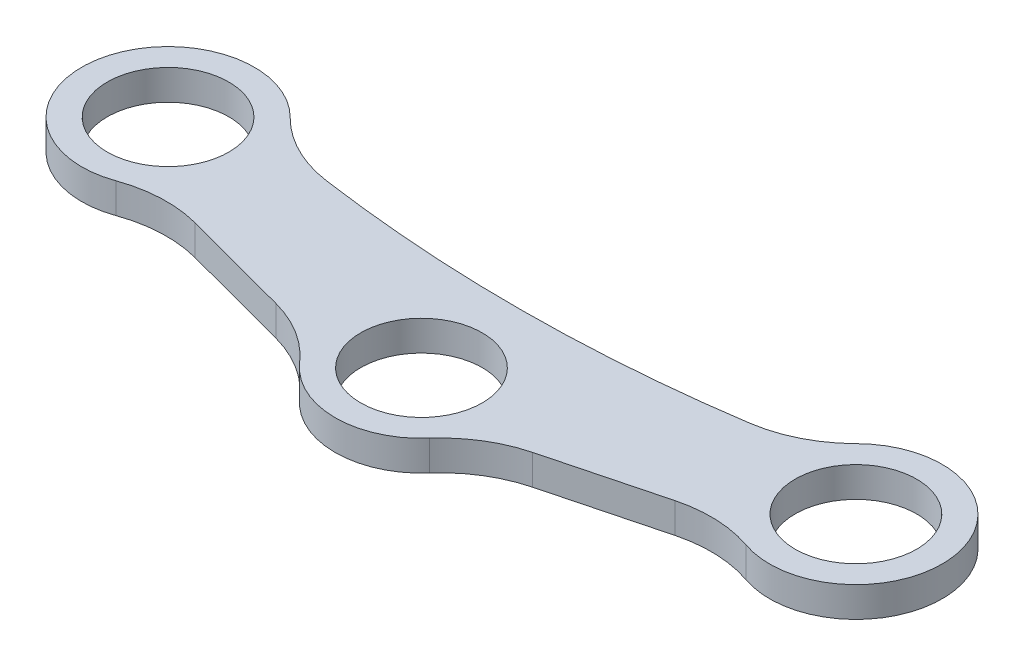
from build123d import *

# Parameters (mm, degrees)
SKETCH1_R           = 4.05
BOSS_EXTRUDE1_DEPTH = 5
SCALE1_SCALE        = 0.471698113
SKETCH2_R           = 1.910377358
BOSS_EXTRUDE2_DEPTH = 4.716981
SKETCH3_R           = 9.5
CUT_EXTRUDE1_DEPTH  = 78.491048109
FILLET1_R           = 20


with BuildPart() as part:
    # Sketch1 → Boss-Extrude1 (new, symmetric)
    with BuildSketch(Plane(origin=(0, 0, 0), x_dir=(1, 0, 0), z_dir=(0, 1, 0))):
        with BuildLine():
            Line((-115.945353012, 22.704926206), (-2.044938074, -7.668517777))
            ThreePointArc((-2.044938074, -7.668517777), (-0.023122965, -7.936460291), (2.000219114, -7.680303388))
            Line((2.000219114, -7.680303388), (116.075928336, 22.028993564))
            ThreePointArc((116.075928336, 22.028993564), (121.992194313, 31.992800071), (112.09054435, 38.012515284))
            ThreePointArc((112.09054435, 38.012515284), (-0.062996347, 24.666684437), (-112.292885137, 37.35447203))
            ThreePointArc((-112.292885137, 37.35447203), (-121.325741435, 31.826475412), (-115.945353012, 22.704926206))
        make_face()
        with Locations(Location((0, 0, 0), (0, 0, 270))):
            Circle(SKETCH1_R, mode=Mode.SUBTRACT)
        with Locations(Location((114, 30, 0), (0, 0, 270))):
            Circle(SKETCH1_R, mode=Mode.SUBTRACT)
        with Locations(Location((-114, 30, 0), (0, 0, 270))):
            Circle(SKETCH1_R, mode=Mode.SUBTRACT)
    extrude(amount=BOSS_EXTRUDE1_DEPTH, both=True)


with BuildPart() as part_1:
    # Scale1: scaled about (1.578802129, 0, -17.052920202)
    add(part.part.scale(SCALE1_SCALE).moved(Location((0.834084144, 0, -9.009089918))))

    # Sketch2 → Boss-Extrude2 (add, through all)
    with BuildSketch(Plane(origin=(0, 2.358490566, 0), x_dir=(1, 0, 0), z_dir=(0, 1, 0))):
        with BuildLine():
            Line((13.487042299, 4.302429752), (45.990989369, 12.76759225))
            ThreePointArc((45.990989369, 12.76759225), (67.744107555, 26.27194324), (42.244562907, 28.582542559))
            ThreePointArc((42.244562907, 28.582542559), (0.907570824, 24.644667364), (-40.455525682, 28.298161983))
            ThreePointArc((-40.455525682, 28.298161983), (-66.076792027, 26.268341249), (-44.081633602, 12.97238445))
            Line((-44.081633602, 12.97238445), (-11.846084783, 4.376238098))
            ThreePointArc((-11.846084783, 4.376238098), (0.794751912, -4.490852784), (13.487042299, 4.302429752))
        make_face()
        with Locations(Location((54.607669049, 23.160033314, 0), (0, 0, 270))):
            Circle(SKETCH2_R, mode=Mode.SUBTRACT)
        with Locations(Location((0.834084144, 9.009089918, 0), (0, 0, 270))):
            Circle(SKETCH2_R, mode=Mode.SUBTRACT)
        with Locations(Location((-52.939500762, 23.160033314, 0), (0, 0, 270))):
            Circle(SKETCH2_R, mode=Mode.SUBTRACT)
    extrude(amount=-BOSS_EXTRUDE2_DEPTH)

    # Sketch3 → Cut-Extrude1 (cut, through all)
    with BuildSketch(Plane(origin=(0, 2.358490566, 0), x_dir=(1, 0, 0), z_dir=(0, 1, 0))):
        with Locations(Location((-52.939500762, 23.160033314, 0), (0, 0, 270))):
            Circle(SKETCH3_R)
        with Locations(Location((0.834084144, 9.009089918, 0), (0, 0, 270))):
            Circle(SKETCH3_R)
        with Locations(Location((54.607669049, 23.160033314, 0), (0, 0, 270))):
            Circle(SKETCH3_R)
    extrude(amount=-CUT_EXTRUDE1_DEPTH, mode=Mode.SUBTRACT)

    # Fillet1
    fillet1_edges = [part_1.edges().sort_by_distance(p)[0] for p in [
        (42.244562907, 6.6e-08, -28.582542559),
        (45.990989369, 6.6e-08, -12.76759225),
        (13.487042299, 6.6e-08, -4.302429752),
        (-11.846084783, 6.6e-08, -4.376238098),
        (-44.081633602, 6.6e-08, -12.97238445),
        (-40.455525682, 6.6e-08, -28.298161983),
    ]]
    fillet(fillet1_edges, radius=FILLET1_R)


solid = part_1.part
